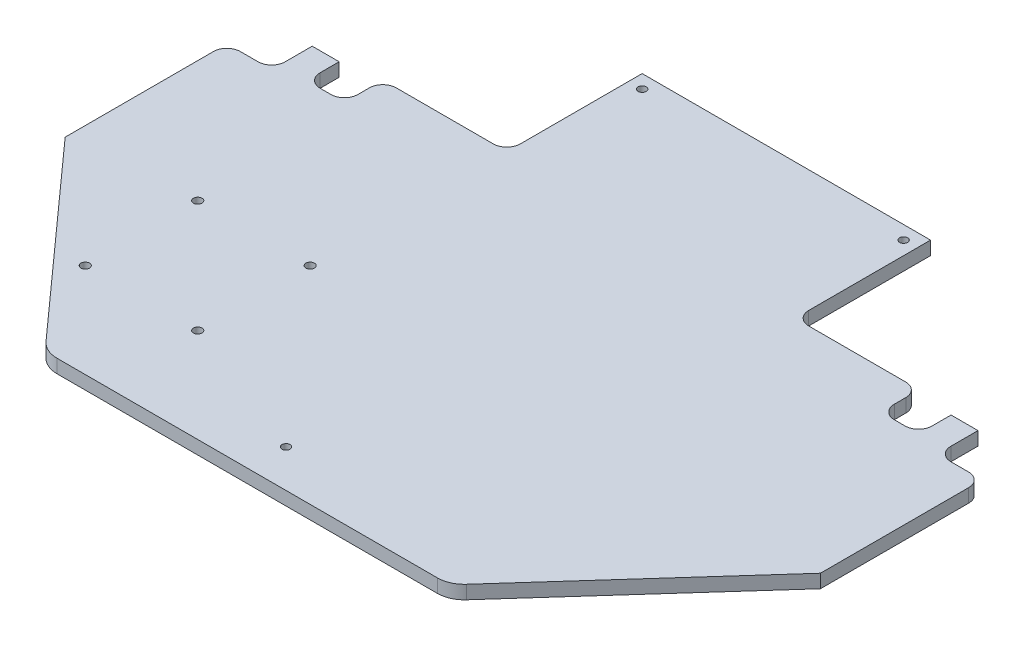
from build123d import *

# Parameters (mm, degrees)
ESQUISSE1_W              = 280.2
ESQUISSE1_H              = 276.282873123
BOSS_EXTRU_1_DEPTH       = 5
ENL_V_MAT_EXTRU_3_DEPTH  = 283.344868376
ENL_V_MAT_EXTRU_5_DEPTH  = 283.344868376
ESQUISSE8_R              = 1.5
ENL_V_MAT_EXTRU_8_DEPTH  = 283.344868376
ENL_V_MAT_EXTRU_15_DEPTH = 283.344868376
CONG_1_R                 = 10
ESQUISSE13_R             = 1.5
ENL_V_MAT_EXTRU_16_DEPTH = 220.422993326
ESQUISSE14_R             = 1.6
ENL_V_MAT_EXTRU_17_DEPTH = 220.422993326


with BuildPart() as part:
    # Esquisse1 → Boss.-Extru.1 (new body)
    with BuildSketch(Plane(origin=(0, 0, 0), x_dir=(1, 0, 0), z_dir=(0, 1, 0))):
        with Locations((0, -106.941436562)):
            Rectangle(ESQUISSE1_W, ESQUISSE1_H)
    extrude(amount=BOSS_EXTRU_1_DEPTH)

    # Esquisse4 → Enlèv. mat.-Extru.3 (cut, through all)
    with BuildSketch(Plane(origin=(0, 5, 0), x_dir=(1, 0, 0), z_dir=(0, 1, 0))):
        with BuildLine():
            Line((140.1, -245.082873123), (101.1, -245.082873123))
            ThreePointArc((101.1, -245.082873123), (128.677164466, -233.660037589), (140.1, -206.082873123))
            Line((140.1, -206.082873123), (140.1, -245.082873123))
        make_face()
        with BuildLine():
            Line((-101.1, -245.082873123), (-140.1, -245.082873123))
            Line((-140.1, -245.082873123), (-140.1, -206.082873123))
            ThreePointArc((-140.1, -206.082873123), (-128.677164466, -233.660037589), (-101.1, -245.082873123))
        make_face()
    extrude(amount=-ENL_V_MAT_EXTRU_3_DEPTH, mode=Mode.SUBTRACT)

    # Esquisse6 → Enlèv. mat.-Extru.5 (cut, through all)
    with BuildSketch(Plane(origin=(0, 5, 0), x_dir=(1, 0, 0), z_dir=(0, 1, 0))):
        with BuildLine():
            Line((140.1, 31.2), (53.5, 31.2))
            Line((53.5, 31.2), (53.5, -14))
            ThreePointArc((53.5, -14), (54.964466094, -17.535533906), (58.5, -19))
            Line((58.5, -19), (94.5, -19))
            ThreePointArc((94.5, -19), (98.035533906, -20.464466094), (99.5, -24))
            Line((99.5, -24), (99.5, -28.25))
            ThreePointArc((99.5, -28.25), (100.964466094, -31.785533906), (104.5, -33.25))
            Line((104.5, -33.25), (108.5, -33.25))
            ThreePointArc((108.5, -33.25), (112.035533906, -31.785533906), (113.5, -28.25))
            Line((113.5, -28.25), (113.5, -21.2))
            Line((113.5, -21.2), (123.5, -21.2))
            Line((123.5, -21.2), (123.5, -31.25))
            ThreePointArc((123.5, -31.25), (124.964466094, -34.785533906), (128.5, -36.25))
            Line((128.5, -36.25), (135.1, -36.25))
            ThreePointArc((135.1, -36.25), (138.635533906, -37.714466094), (140.1, -41.25))
            Line((140.1, -41.25), (140.1, 31.2))
        make_face()
        with BuildLine():
            Line((-53.5, -14), (-53.5, 31.2))
            Line((-53.5, 31.2), (-140.1, 31.2))
            Line((-140.1, 31.2), (-140.1, -41.25))
            ThreePointArc((-140.1, -41.25), (-138.635533906, -37.714466094), (-135.1, -36.25))
            Line((-135.1, -36.25), (-128.5, -36.25))
            ThreePointArc((-128.5, -36.25), (-124.964466094, -34.785533906), (-123.5, -31.25))
            Line((-123.5, -31.25), (-123.5, -21.2))
            Line((-123.5, -21.2), (-113.5, -21.2))
            Line((-113.5, -21.2), (-113.5, -28.25))
            ThreePointArc((-113.5, -28.25), (-112.035533906, -31.785533906), (-108.5, -33.25))
            Line((-108.5, -33.25), (-104.5, -33.25))
            ThreePointArc((-104.5, -33.25), (-100.964466094, -31.785533906), (-99.5, -28.25))
            Line((-99.5, -28.25), (-99.5, -24))
            ThreePointArc((-99.5, -24), (-98.035533906, -20.464466094), (-94.5, -19))
            Line((-94.5, -19), (-58.5, -19))
            ThreePointArc((-58.5, -19), (-54.964466094, -17.535533906), (-53.5, -14))
        make_face()
    extrude(amount=-ENL_V_MAT_EXTRU_5_DEPTH, mode=Mode.SUBTRACT)

    # Esquisse8 → Enlèv. mat.-Extru.8 (cut, through all)
    with BuildSketch(Plane.XZ):
        with Locations(Location((-48.5, -26.2, 0), (0, 0, 270))):
            Circle(ESQUISSE8_R)
        with Locations(Location((48.5, -26.2, 0), (0, 0, 270))):
            Circle(ESQUISSE8_R)
    extrude(amount=-ENL_V_MAT_EXTRU_8_DEPTH, mode=Mode.SUBTRACT)

    # Esquisse12 → Enlèv. mat.-Extru.15 (cut, through all)
    with BuildSketch(Plane(origin=(0, 5, 0), x_dir=(1, 0, 0), z_dir=(0, 1, 0))):
        Polygon((-140.1, -96.25), (-75, -168.8), (75, -168.8), (140.1, -96.25), (146.03275504, -294.983631094), (-140.1, -294.983631094), align=None)
    extrude(amount=-ENL_V_MAT_EXTRU_15_DEPTH, mode=Mode.SUBTRACT)

    # Congé1
    cong_1_edges = [part.edges().sort_by_distance(p)[0] for p in [
        (-75, 2.5, 168.8),
        (75, 2.5, 168.8),
    ]]
    fillet(cong_1_edges, radius=CONG_1_R)

    # Esquisse13 → Enlèv. mat.-Extru.16 (cut, through all)
    with BuildSketch(Plane(origin=(0, 5, 0), x_dir=(1, 0, 0), z_dir=(0, 1, 0))):
        with Locations(Location((0.38736006, -154.8, 0), (0, 0, 270))):
            Circle(ESQUISSE13_R)
    extrude(amount=-ENL_V_MAT_EXTRU_16_DEPTH, mode=Mode.SUBTRACT)

    # Esquisse14 → Enlèv. mat.-Extru.17 (cut, through all)
    with BuildSketch(Plane(origin=(0, 5, 0), x_dir=(1, 0, 0), z_dir=(0, 1, 0))):
        with Locations(Location((-95.1, -133.8, 0), (0, 0, 270))):
            Circle(ESQUISSE14_R)
        with Locations(Location((-53.38, -133.8, 0), (0, 0, 270))):
            Circle(ESQUISSE14_R)
        with Locations(Location((-95.1, -92.08, 0), (0, 0, 270))):
            Circle(ESQUISSE14_R)
        with Locations(Location((-53.38, -92.08, 0), (0, 0, 270))):
            Circle(ESQUISSE14_R)
    extrude(amount=-ENL_V_MAT_EXTRU_17_DEPTH, mode=Mode.SUBTRACT)


solid = part.part
